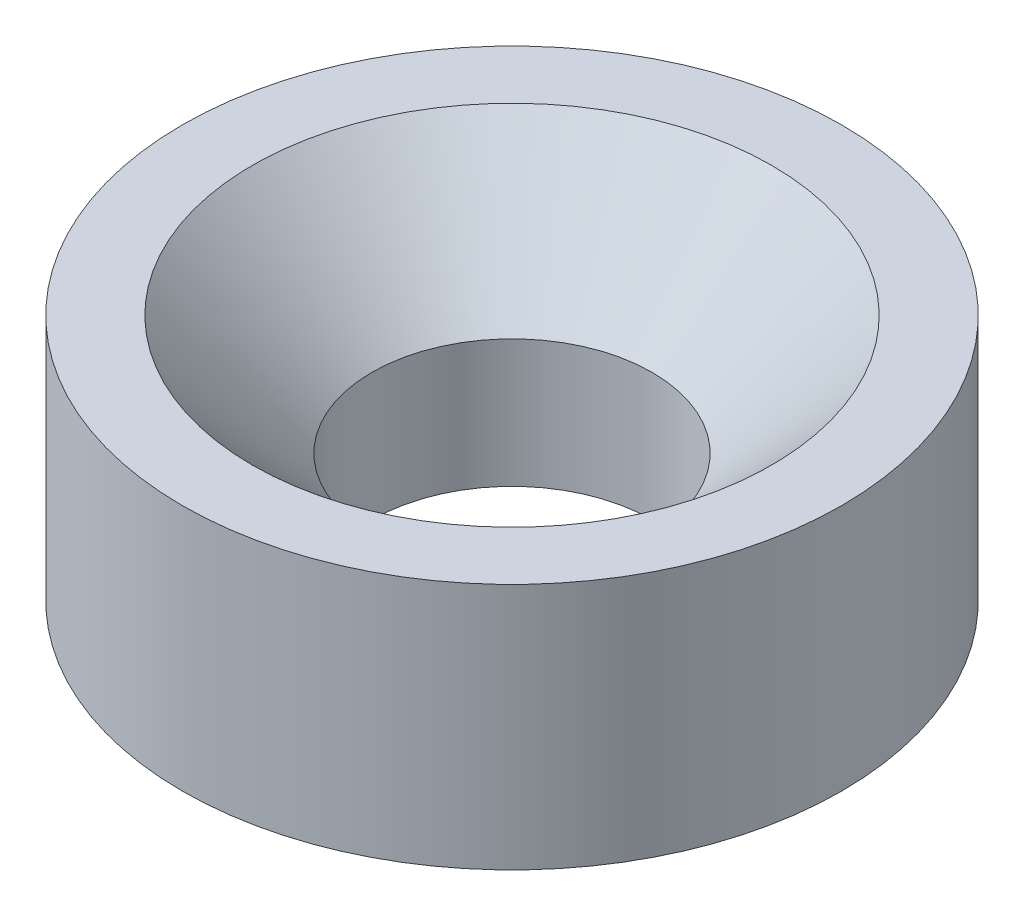
from build123d import *

# Parameters (mm, degrees)
SKETCH1_R           = 4
BOSS_EXTRUDE1_DEPTH = 3


with BuildPart() as part:
    # Sketch1 → Boss-Extrude1 (new body)
    with BuildSketch(Plane(origin=(0, 0, 0), x_dir=(1, 0, 0), z_dir=(0, 1, 0))):
        with Locations(Location((0, 0, 0), (0, 0, 270))):
            Circle(SKETCH1_R)
    extrude(amount=BOSS_EXTRUDE1_DEPTH)

    # Sketch3 → CSK for M3 Countersunk Flat Head Screw1 (revolve, cut)
    with BuildSketch(Plane(origin=(0, 3, 0), x_dir=(0, 0, 1), z_dir=(1, 0, 0))):
        Polygon((0, 0), (0, 3), (1.7, 3), (1.7, 1.45), (3.15, 0), align=None)
    revolve(axis=Axis((0, 9.35, 0), (0, -1, 0)), mode=Mode.SUBTRACT)


solid = part.part
